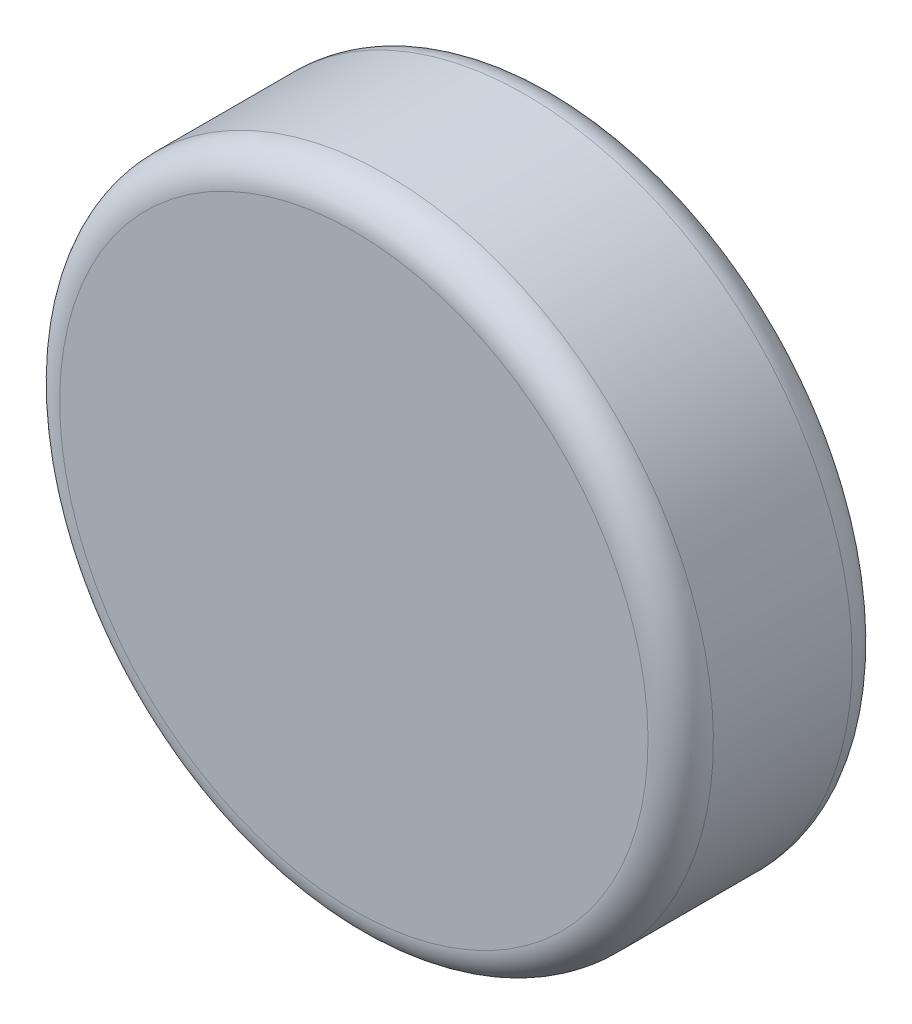
from build123d import *

# Parameters (mm, degrees)
SKETCH1_R           = 4
BOSS_EXTRUDE1_DEPTH = 2.5
FILLET1_R           = 0.4


with BuildPart() as part:
    # Sketch1 → Boss-Extrude1 (new body)
    with BuildSketch(Plane(origin=(0, 0, 16.895), x_dir=(-1, 0, 0), z_dir=(0, 0, -1))):
        with Locations(Location((4.95, -15.400000468, 0), (0, 0, 90))):
            Circle(SKETCH1_R)
    extrude(amount=BOSS_EXTRUDE1_DEPTH)

    # Fillet1
    fillet1_edges = [part.edges().sort_by_distance(p)[0] for p in [
        (-4.95, -19.400000468, 16.895),
        (-4.95, -19.400000468, 14.395),
    ]]
    fillet(fillet1_edges, radius=FILLET1_R)


solid = part.part
